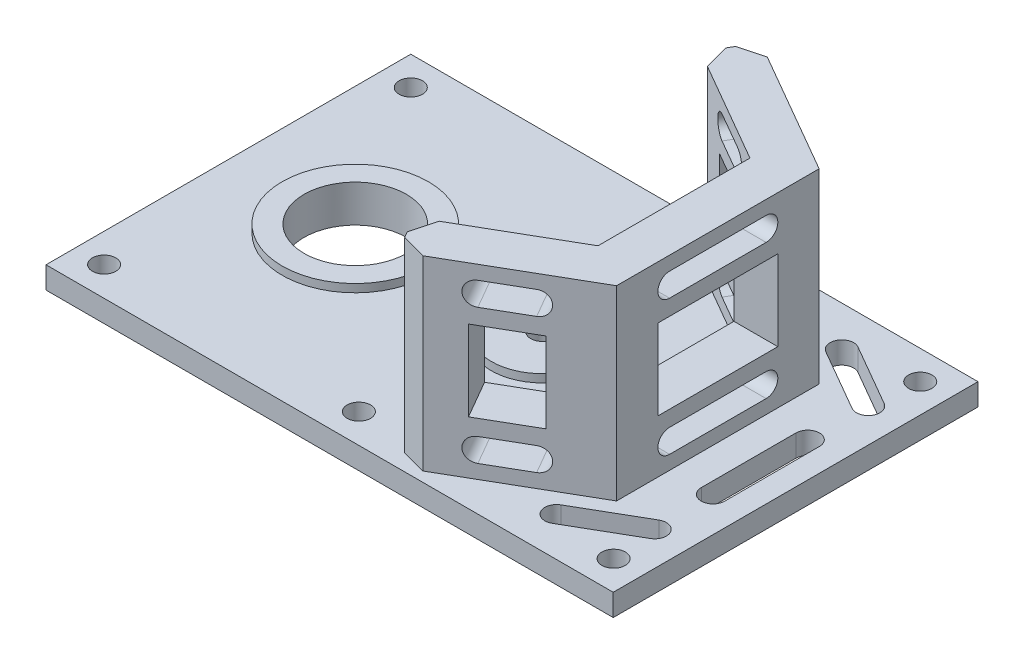
from build123d import *

# Parameters (mm, degrees)
SKETCH1_W            = 77.5936289
SKETCH1_H            = 49.9
SKETCH1_R            = 7
SKETCH1_R_2          = 1.6
BOSS_EXTRUDE6_DEPTH  = 3
SKETCH7_R            = 10
SKETCH7_R_2          = 7
BOSS_EXTRUDE7_DEPTH  = 1.1
BOSS_EXTRUDE9_START  = 1
SKETCH9_R            = 10
SKETCH9_R_2          = 7
BOSS_EXTRUDE9_DEPTH  = 1
SKETCH8_R            = 1.5
BOSS_EXTRUDE8_DEPTH  = 0.1
BOSS_EXTRUDE10_DEPTH = 25.5
SKETCH11_W           = 7.767839657
SKETCH11_H           = 11
CUT_EXTRUDE3_DEPTH   = 60.057720192
CUT_EXTRUDE4_DEPTH   = 11
CHAMFER2_SIZE        = 2.5
CHAMFER3_SIZE        = 2.5
SKETCH12_R           = 1.6
CUT_EXTRUDE5_DEPTH   = 4.2
SKETCH15_W           = 16.405303922
SKETCH15_H           = 11
CUT_EXTRUDE6_DEPTH   = 6
CUT_EXTRUDE7_DEPTH   = 3


with BuildPart() as part:
    # Sketch1 → Boss-Extrude6 (new body)
    with BuildSketch(Plane(origin=(0, 0, 0), x_dir=(1, 0, 0), z_dir=(0, 1, 0))):
        with Locations((-11.20318555, 0.05)):
            Rectangle(SKETCH1_W, SKETCH1_H)
        with Locations(Location((-32.593845483, 0, 0), (0, 0, 270))):
            Circle(SKETCH1_R, mode=Mode.SUBTRACT)
        with Locations(Location((-46.05, 21.05, 0), (0, 0, 270))):
            Circle(SKETCH1_R_2, mode=Mode.SUBTRACT)
        with Locations(Location((-46.05, -20.9, 0), (0, 0, 270))):
            Circle(SKETCH1_R_2, mode=Mode.SUBTRACT)
        with Locations(Location((23.6436289, -20.9, 0), (0, 0, 270))):
            Circle(SKETCH1_R_2, mode=Mode.SUBTRACT)
        with Locations(Location((23.6436289, 21.05, 0), (0, 0, 270))):
            Circle(SKETCH1_R_2, mode=Mode.SUBTRACT)
        with Locations(Location((-11.20318555, -20.9, 0), (0, 0, 270))):
            Circle(SKETCH1_R_2, mode=Mode.SUBTRACT)
        with Locations(Location((-11.20318555, 21.05, 0), (0, 0, 270))):
            Circle(SKETCH1_R_2, mode=Mode.SUBTRACT)
    extrude(amount=BOSS_EXTRUDE6_DEPTH)

    # Sketch7 → Boss-Extrude7 (add)
    # profile 1 of 2: a face of its own
    with BuildSketch(Plane(origin=(0, 3, 0), x_dir=(1, 0, 0), z_dir=(0, 1, 0))):
        with Locations(Location((-32.593845483, 0, 0), (0, 0, 90))):
            Circle(SKETCH7_R)
        with Locations(Location((-32.593845483, 0, 0), (0, 0, 270))):
            Circle(SKETCH7_R_2, mode=Mode.SUBTRACT)
    # profile 2 of 2: a face of its own
    with BuildSketch(Plane(origin=(0, 3, 0), x_dir=(1, 0, 0), z_dir=(0, 1, 0))):
        with Locations(Location((-6.993845483, 0, 0), (0, 0, 90))):
            Circle(SKETCH7_R_2)
    extrude(amount=BOSS_EXTRUDE7_DEPTH)

    # Sketch9 → Boss-Extrude9 (add)
    with BuildSketch(Plane.XZ.offset(BOSS_EXTRUDE9_START)):
        with Locations(Location((-32.593845483, 0, 0), (0, 0, 270))):
            Circle(SKETCH9_R)
        with Locations(Location((-32.593845483, 0, 0), (0, 0, 270))):
            Circle(SKETCH9_R_2, mode=Mode.SUBTRACT)
    extrude(amount=-BOSS_EXTRUDE9_DEPTH)

    # Sketch8 → Boss-Extrude8 (add)
    with BuildSketch(Plane(origin=(0, 4.1, 0), x_dir=(1, 0, 0), z_dir=(0, 1, 0))):
        with Locations(Location((-6.993845483, 0, 0), (0, 0, 270))):
            Circle(SKETCH8_R)
    extrude(amount=BOSS_EXTRUDE8_DEPTH)

    # Sketch10 → Boss-Extrude10 (add)
    with BuildSketch(Plane(origin=(0, 3, 0), x_dir=(1, 0, 0), z_dir=(0, 1, 0))):
        Polygon((11.006154517, 10.392304845), (-4.95090881, 19.605119652), (-1.95090881, 24.801272075), (17.006154517, 13.856406461), (17.006154517, -13.856406461), (-1.95090881, -24.801272075), (-4.95090881, -19.605119652), (11.006154517, -10.392304845), align=None)
    extrude(amount=BOSS_EXTRUDE10_DEPTH)

    # Sketch11 → Cut-Extrude3 (cut)
    with BuildSketch(Plane(origin=(10.251538629, 0, 17.756185762), x_dir=(0.8660254037844386, 0, -0.5000000000000001), z_dir=(0.5000000000000001, 0, 0.8660254037844386))):
        with BuildLine():
            Line((-6.090172627, 26.6), (-0.200441398, 26.6))
            ThreePointArc((-0.200441398, 26.6), (1.399558602, 25), (-0.200441398, 23.4))
            Line((-0.200441398, 23.4), (-6.090172627, 23.4))
            ThreePointArc((-6.090172627, 23.4), (-7.690172627, 25), (-6.090172627, 26.6))
        make_face()
        with BuildLine():
            Line((-6.090172627, 8.1), (-0.200441398, 8.1))
            ThreePointArc((-0.200441398, 8.1), (1.399558602, 6.5), (-0.200441398, 4.9))
            Line((-0.200441398, 4.9), (-6.090172627, 4.9))
            ThreePointArc((-6.090172627, 4.9), (-7.690172627, 6.5), (-6.090172627, 8.1))
        make_face()
        with Locations((-3.145307013, 15.75)):
            Rectangle(SKETCH11_W, SKETCH11_H)
    cut_extrude3 = extrude(amount=-CUT_EXTRUDE3_DEPTH, mode=Mode.SUBTRACT)

    # Mirror4: Cut-Extrude3 across plane
    add(cut_extrude3.mirror(Plane.XY), mode=Mode.SUBTRACT)

    # Sketch13 → Cut-Extrude4 (cut)
    with BuildSketch(Plane(origin=(0, 3, 0), x_dir=(1, 0, 0), z_dir=(0, 1, 0))):
        with BuildLine():
            Line((13.661155176, -18.122101509), (22.159879545, -13.215360707))
            ThreePointArc((22.159879545, -13.215360707), (24.352350318, -13.80283148), (23.764879545, -15.995302253))
            Line((23.764879545, -15.995302253), (15.266155176, -20.902043055))
            ThreePointArc((15.266155176, -20.902043055), (13.073684403, -20.314572282), (13.661155176, -18.122101509))
        make_face()
    cut_extrude4 = extrude(amount=-CUT_EXTRUDE4_DEPTH, mode=Mode.SUBTRACT)

    # Mirror5: Cut-Extrude4 across plane
    add(cut_extrude4.mirror(Plane.XY), mode=Mode.SUBTRACT)

    # Chamfer2
    chamfer2_edges = [part.edges().sort_by_distance(p)[0] for p in [
        (-4.95090881, 15.75, 19.605119652),
        (-4.95090881, 15.75, -19.605119652),
    ]]
    chamfer(chamfer2_edges, length=CHAMFER2_SIZE)

    # Chamfer3
    chamfer3_edges = [part.edges().sort_by_distance(p)[0] for p in [
        (-1.95090881, 15.75, 24.801272075),
        (-1.95090881, 15.75, -24.801272075),
    ]]
    chamfer(chamfer3_edges, length=CHAMFER3_SIZE)

    # Sketch12 → Cut-Extrude5 (cut)
    with BuildSketch(Plane(origin=(0, 4.2, 0), x_dir=(1, 0, 0), z_dir=(0, 1, 0))):
        with Locations(Location((-6.993845483, 0, 0), (0, 0, 270))):
            Circle(SKETCH12_R)
    extrude(amount=-CUT_EXTRUDE5_DEPTH, mode=Mode.SUBTRACT)

    # Sketch15 → Cut-Extrude6 (cut)
    with BuildSketch(Plane(origin=(17.006154517, 0, 0), x_dir=(0, 0, -1), z_dir=(1, 0, 0))):
        with Locations((0, 15.75)):
            Rectangle(SKETCH15_W, SKETCH15_H)
        with BuildLine():
            Line((-6.602651961, 26.6), (6.602651961, 26.6))
            ThreePointArc((6.602651961, 26.6), (8.202651961, 25), (6.602651961, 23.4))
            Line((6.602651961, 23.4), (-6.602651961, 23.4))
            ThreePointArc((-6.602651961, 23.4), (-8.202651961, 25), (-6.602651961, 26.6))
        make_face()
        with BuildLine():
            Line((-6.602651961, 4.9), (6.602651961, 4.9))
            ThreePointArc((6.602651961, 4.9), (8.202651961, 6.5), (6.602651961, 8.1))
            Line((6.602651961, 8.1), (-6.602651961, 8.1))
            ThreePointArc((-6.602651961, 8.1), (-8.202651961, 6.5), (-6.602651961, 4.9))
        make_face()
    extrude(amount=-CUT_EXTRUDE6_DEPTH, mode=Mode.SUBTRACT)

    # Sketch16 → Cut-Extrude7 (cut)
    with BuildSketch(Plane(origin=(0, 3, 0), x_dir=(1, 0, 0), z_dir=(0, 1, 0))):
        with BuildLine():
            Line((21.215137645, -6.479589384), (21.215137645, 6.479589384))
            ThreePointArc((21.215137645, 6.479589384), (22.820137645, 8.084589384), (24.425137645, 6.479589384))
            Line((24.425137645, 6.479589384), (24.425137645, -6.479589384))
            ThreePointArc((24.425137645, -6.479589384), (22.820137645, -8.084589384), (21.215137645, -6.479589384))
        make_face()
    extrude(amount=-CUT_EXTRUDE7_DEPTH, mode=Mode.SUBTRACT)


solid = part.part
